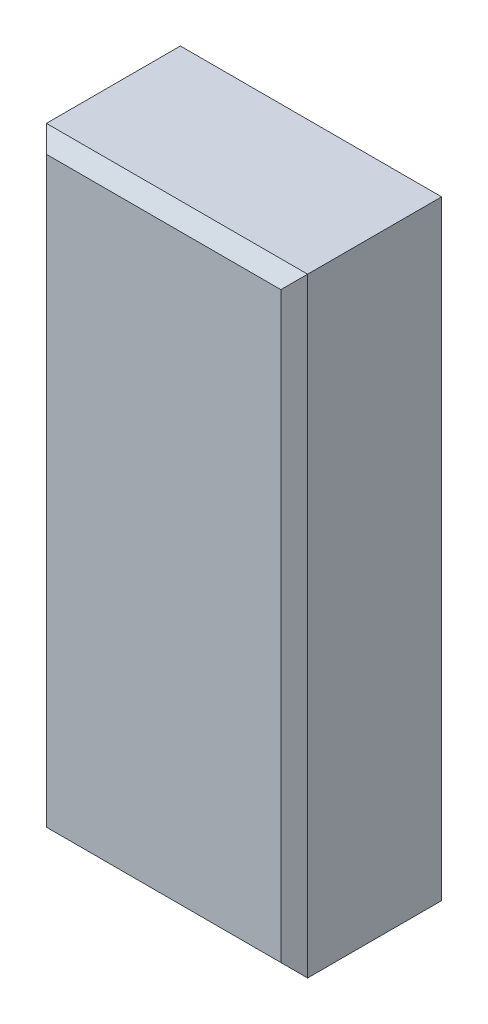
from build123d import *

# Parameters (mm, degrees)
SKETCH1_W           = 19.5
SKETCH1_H           = 45.5
BOSS_EXTRUDE1_DEPTH = 11
CHAMFER1_SIZE       = 1


with BuildPart() as part:
    # Sketch1 → Boss-Extrude1 (new body)
    with BuildSketch(Plane.XY):
        Rectangle(SKETCH1_W, SKETCH1_H)
    extrude(amount=BOSS_EXTRUDE1_DEPTH)

    # Chamfer1
    chamfer1_edges = [part.edges().sort_by_distance(p)[0] for p in [
        (-9.75, 0, 11),
        (0, -22.75, 11),
        (9.75, 0, 11),
        (0, 22.75, 11),
    ]]
    chamfer(chamfer1_edges, length=CHAMFER1_SIZE)


solid = part.part
